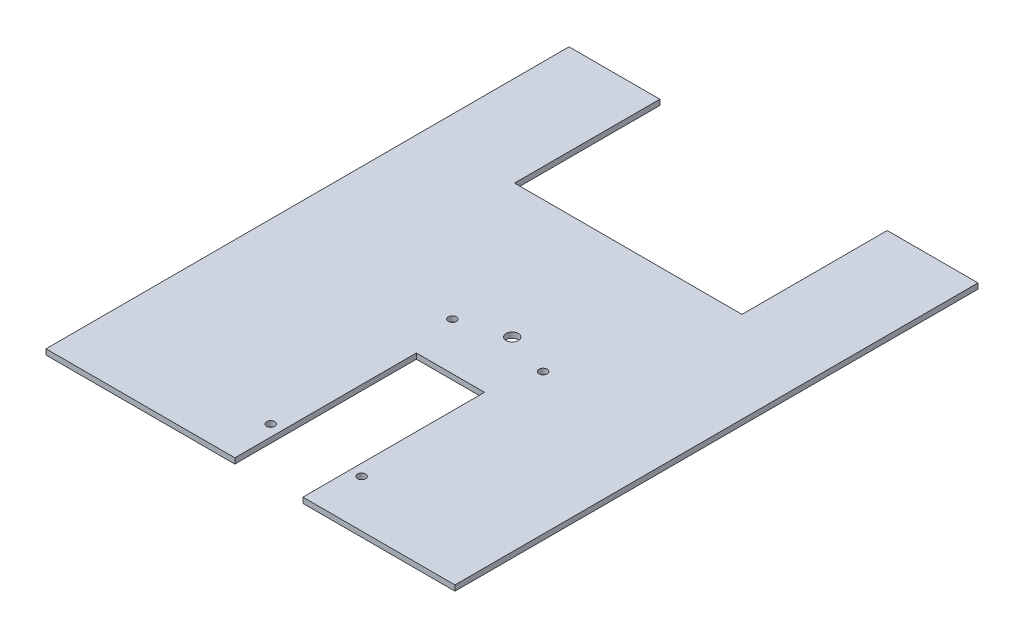
from build123d import *

# Parameters (mm, degrees)
SKETCH1_W                   = 225.24
SKETCH1_H                   = 288.07
BOSS_EXTRUDE1_DEPTH         = 1.5
M4_CLEARANCE_HOLE1_D        = 4.5
F_1_4_CLEARANCE_HOLE1_D     = 6.7564
F_1_4_CLEARANCE_HOLE1_DEPTH = 20
F_1_4_CLEARANCE_HOLE1_TIP   = 2.029827343
SKETCH6_W                   = 125.24
SKETCH6_H                   = 80
SKETCH6_W_2                 = 37.51
SKETCH6_H_2                 = 100
CUT_EXTRUDE1_DEPTH          = 183.861547694


with BuildPart() as part:
    # Sketch1 → Boss-Extrude1 (new, symmetric)
    with BuildSketch(Plane(origin=(0, 0, 0), x_dir=(1, 0, 0), z_dir=(0, 1, 0))):
        Rectangle(SKETCH1_W, SKETCH1_H)
    extrude(amount=BOSS_EXTRUDE1_DEPTH, both=True)

    # M4 Clearance Hole1 (through all)
    with Locations(Plane(origin=(0, 1.5, 0), x_dir=(1, 0, 0), z_dir=(0, 1, 0))):
        with Locations((-14.88, -117.99), (-14.88, -17.99), (35.13, -117.99), (35.13, -17.99)):
            Hole(M4_CLEARANCE_HOLE1_D / 2)

    # 1/4 Clearance Hole1
    with Locations(Plane(origin=(0, 1.5, 0), x_dir=(1, 0, 0), z_dir=(0, 1, 0))):
        with Locations((10.125, -10.035)):
            Hole(F_1_4_CLEARANCE_HOLE1_D / 2, depth=F_1_4_CLEARANCE_HOLE1_DEPTH)
            with Locations((0, 0, -(F_1_4_CLEARANCE_HOLE1_DEPTH + F_1_4_CLEARANCE_HOLE1_TIP / 2))):  # 118° drill point
                Cone(0, F_1_4_CLEARANCE_HOLE1_D / 2, F_1_4_CLEARANCE_HOLE1_TIP, mode=Mode.SUBTRACT)

    # Sketch6 → Cut-Extrude1 (cut, through all)
    with BuildSketch(Plane(origin=(0, 1.5, 0), x_dir=(1, 0, 0), z_dir=(0, 1, 0))):
        with Locations((0, 104.035)):
            Rectangle(SKETCH6_W, SKETCH6_H)
        with Locations((10.125, -94.035)):
            Rectangle(SKETCH6_W_2, SKETCH6_H_2)
    extrude(amount=-CUT_EXTRUDE1_DEPTH, mode=Mode.SUBTRACT)


solid = part.part
